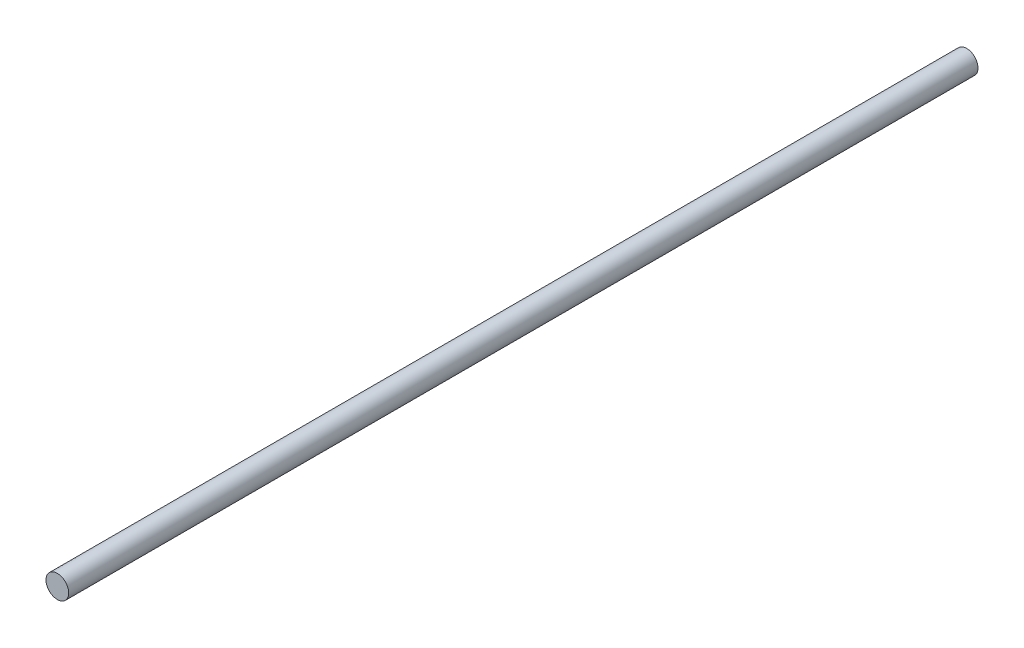
from build123d import *

# Parameters (mm, degrees)
SKETCH1_R           = 1.190625
BOSS_EXTRUDE1_DEPTH = 95.25


with BuildPart() as part:
    # Sketch1 → Boss-Extrude1 (new body)
    with BuildSketch(Plane.XY):
        Circle(SKETCH1_R)
    extrude(amount=BOSS_EXTRUDE1_DEPTH)


solid = part.part
